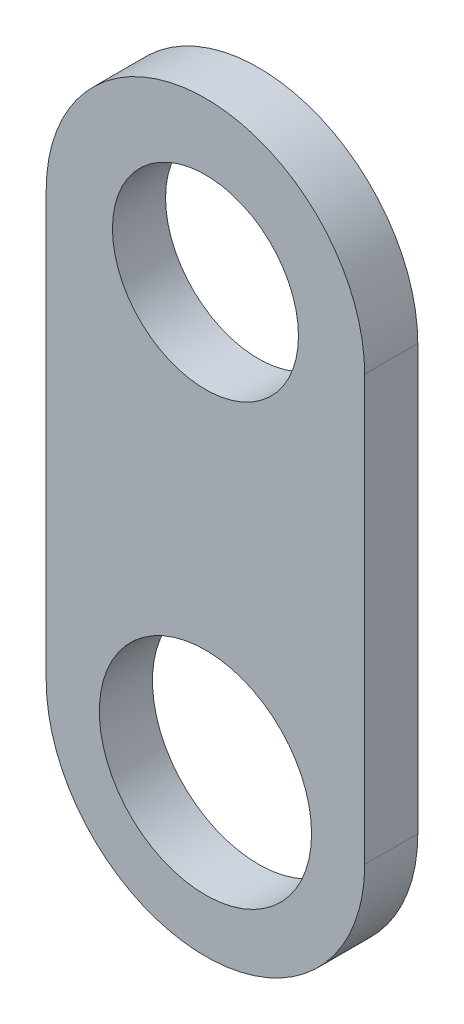
from build123d import *

# Parameters (mm, degrees)
SKETCH2_R           = 11.1252
SKETCH2_R_2         = 12.69365
BOSS_EXTRUDE1_DEPTH = 3.175


with BuildPart() as part:
    # Sketch2 → Boss-Extrude1 (new, symmetric)
    with BuildSketch(Plane.XY):
        with BuildLine():
            Line((-19.05, 0), (-19.05, 50.8))
            ThreePointArc((-19.05, 50.8), (0, 69.85), (19.05, 50.8))
            Line((19.05, 50.8), (19.05, 0))
            ThreePointArc((19.05, 0), (0, -19.05), (-19.05, 0))
        make_face()
        with Locations((0, 50.8)):
            Circle(SKETCH2_R, mode=Mode.SUBTRACT)
        Circle(SKETCH2_R_2, mode=Mode.SUBTRACT)
    extrude(amount=BOSS_EXTRUDE1_DEPTH, both=True)


solid = part.part
